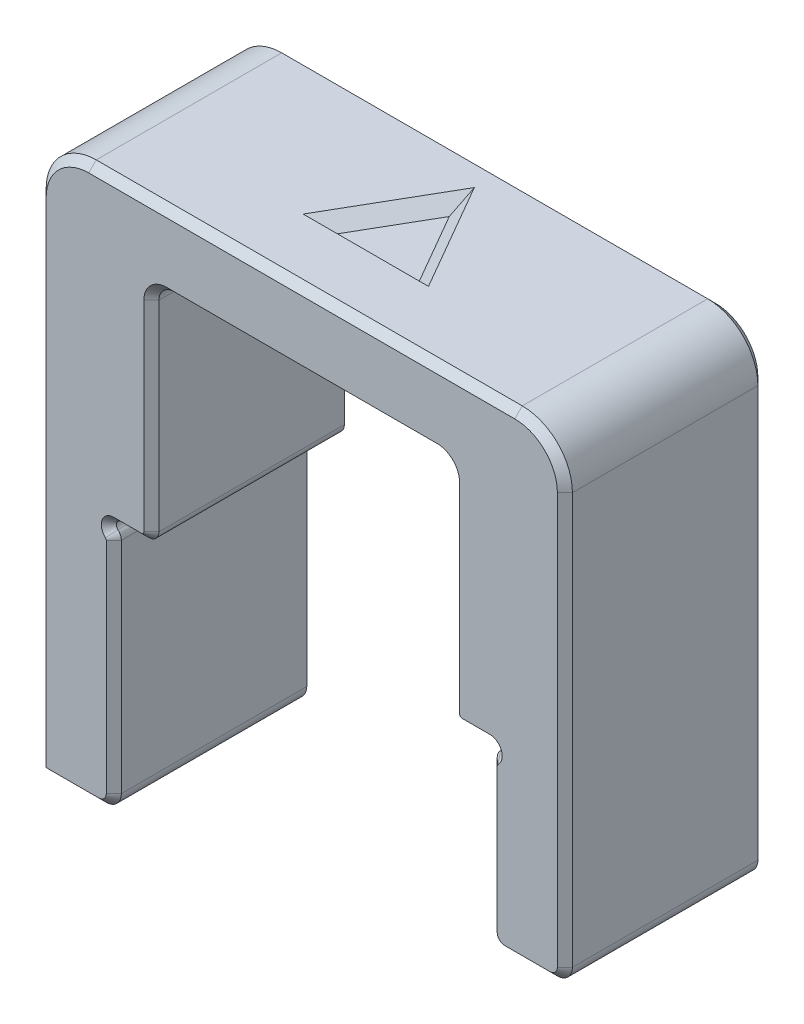
from build123d import *

# Parameters (mm, degrees)
BOSS_EXTRUDE1_DEPTH = 4
SKETCH2_R           = 0.2
CUT_EXTRUDE1_DEPTH  = 8
FILLET2_R           = 0.4
FILLET1_R           = 0.6
FILLET3_R           = 2
BOSS_EXTRUDE2_DEPTH = 8
FILLET4_R           = 0.6
CUT_EXTRUDE2_DEPTH  = 0.5
CUT_EXTRUDE2_DRAFT  = -45
CHAMFER1_SIZE       = 0.3


with BuildPart() as part:
    # Sketch1 → Boss-Extrude1 (new, symmetric)
    with BuildSketch(Plane.XY):
        Polygon((0, 9), (6, 9), (6, 0), (7.5, 0), (7.5, -7), (10.5, -7), (10.5, 12), (0, 12), align=None)
    extrude(amount=BOSS_EXTRUDE1_DEPTH, both=True)

    # Sketch2 → Cut-Extrude1 (cut)
    with BuildSketch(Plane.XY.offset(4)):
        with Locations((7.5, -0.2)):
            Circle(SKETCH2_R)
    extrude(amount=-CUT_EXTRUDE1_DEPTH, mode=Mode.SUBTRACT)

    # Fillet2
    fillet2_edges = [part.edges().sort_by_distance(p)[0] for p in [
        (6, 0, 0),
        (7.5, -0.4, 0),
    ]]
    fillet(fillet2_edges, radius=FILLET2_R)

    # Fillet1
    fillet1_edges = [part.edges().sort_by_distance(p)[0] for p in [
        (10.5, -7, 0),
        (7.5, -7, 0),
        (6, 9, 0),
    ]]
    fillet(fillet1_edges, radius=FILLET1_R)

    # Fillet3
    fillet3_edges = [part.edges().sort_by_distance(p)[0] for p in [
        (10.5, 12, 0),
    ]]
    fillet(fillet3_edges, radius=FILLET3_R)

    # Mirror1: part across plane


with BuildPart() as part_1:
    add(part.part)
    add(part.part.mirror(Plane(origin=(0, 12, 4), x_dir=(0, 0, 1), z_dir=(1, 0, 0))))

    # Sketch3 → Boss-Extrude2 (add)
    with BuildSketch(Plane.XY.offset(4)):
        with BuildLine():
            Line((-8.1, -7), (-9.9, -7))
            ThreePointArc((-9.9, -7), (-10.324264069, -6.824264069), (-10.5, -6.4))
            Line((-10.5, -6.4), (-10.5, -10))
            Line((-10.5, -10), (-7.5, -10))
            Line((-7.5, -10), (-7.5, -6.4))
            ThreePointArc((-7.5, -6.4), (-7.675735931, -6.824264069), (-8.1, -7))
        make_face()
    extrude(amount=-BOSS_EXTRUDE2_DEPTH)

    # Fillet4
    fillet4_edges = [part_1.edges().sort_by_distance(p)[0] for p in [
        (-7.5, -10, 0),
    ]]
    fillet(fillet4_edges, radius=FILLET4_R)


with BuildPart() as cut_extrude2_tool:
    # Sketch4 → Cut-Extrude2 (with draft: the straight prism first)
    with BuildSketch(Plane(origin=(0, 12, 0), x_dir=(1, 0, 0), z_dir=(0, 1, 0))):
        Polygon((-2.5, -1.443375673), (2.5, -1.443375673), (0, 2.886751346), align=None)
    extrude(amount=-CUT_EXTRUDE2_DEPTH)
    # Cut-Extrude2: the draft: its side faces are tilted about the plane it starts from
    cut_extrude2_sides = [cut_extrude2_tool.faces().sort_by_distance(p)[0] for p in [
        (0, 11.75, 1.443375673),
        (1.25, 11.75, -0.721687836),
        (-1.25, 11.75, -0.721687836),
    ]]
    draft(cut_extrude2_sides, Plane(origin=(0, 12, 0), x_dir=(1, 0, 0), z_dir=(0, 1, 0)), CUT_EXTRUDE2_DRAFT)


with BuildPart() as part_2:
    add(part_1.part)

    # Cut-Extrude2: cut by cut_extrude2_tool
    add(cut_extrude2_tool.part, mode=Mode.SUBTRACT)

    # Chamfer1
    chamfer1_edges = [part_2.edges().sort_by_distance(p)[0] for p in [
        (-9.3, -10, 4),
        (0, 9, -4),
        (-9.3, -10, -4),
        (-7.675735931, -9.824264069, 4),
        (-7.675735931, -9.824264069, -4),
        (6.95, 0, -4),
        (6.95, 0, 4),
        (7.5, -3.523606798, -4),
        (7.686834472, -0.128635582, -4),
        (7.534851628, -0.483914279, -4),
        (6.117157288, 0.117157288, -4),
        (7.686834472, -0.128635582, 4),
        (7.5, -3.523606798, 4),
        (7.534851628, -0.483914279, 4),
        (6.117157288, 0.117157288, 4),
        (10.5, 1.8, -4),
        (10.5, 1.8, 4),
        (6, 4.4, -4),
        (9, -7, -4),
        (7.675735931, -6.824264069, -4),
        (10.324264069, -6.824264069, -4),
        (9, -7, 4),
        (6, 4.4, 4),
        (7.675735931, -6.824264069, 4),
        (10.324264069, -6.824264069, 4),
        (5.824264069, 8.824264069, -4),
        (5.824264069, 8.824264069, 4),
        (0, 12, -4),
        (0, 12, 4),
        (9.914213562, 11.414213562, -4),
        (9.914213562, 11.414213562, 4),
        (-6, 4.4, 4),
        (-6.95, 0, 4),
        (-7.5, -5.023606798, 4),
        (-10.5, 0, 4),
        (-7.686834472, -0.128635582, 4),
        (-6, 4.4, -4),
        (-6.95, 0, -4),
        (-7.5, -5.023606798, -4),
        (-10.5, 0, -4),
        (-7.686834472, -0.128635582, -4),
        (-6.117157288, 0.117157288, 4),
        (-6.117157288, 0.117157288, -4),
        (-7.534851628, -0.483914279, 4),
        (-7.534851628, -0.483914279, -4),
        (-5.824264069, 8.824264069, 4),
        (-5.824264069, 8.824264069, -4),
        (-9.914213562, 11.414213562, 4),
        (-9.914213562, 11.414213562, -4),
        (0, 9, 4),
    ]]
    chamfer(chamfer1_edges, length=CHAMFER1_SIZE)


solid = part_2.part
